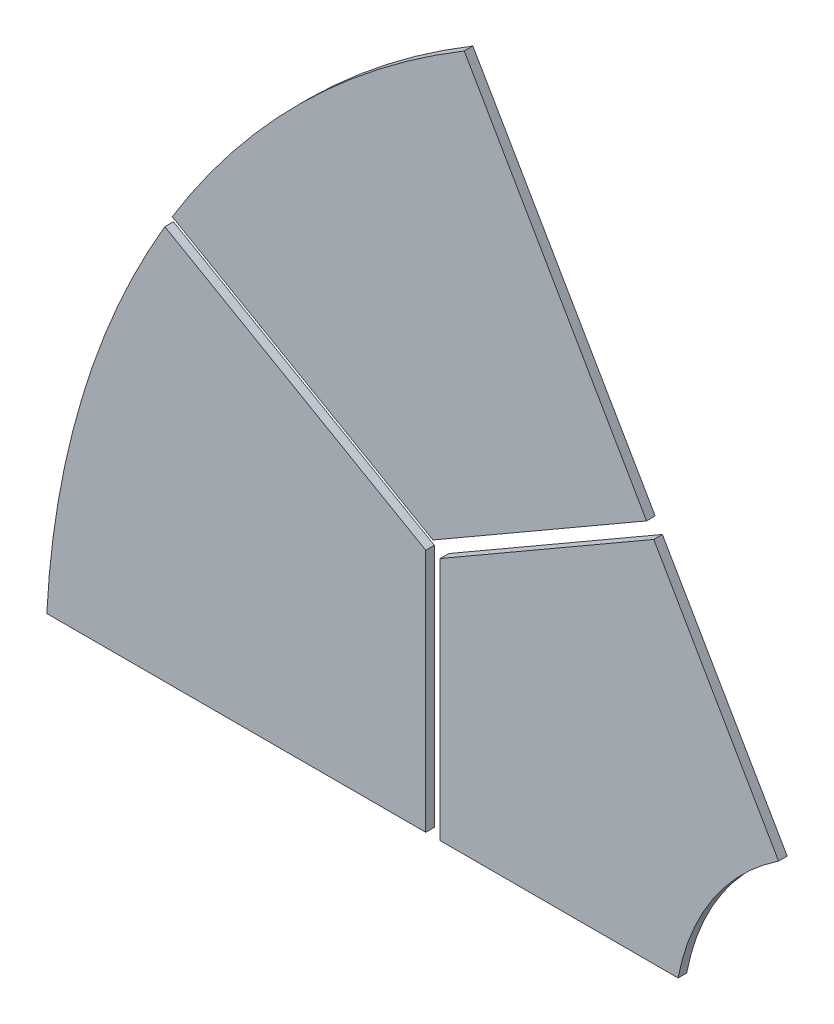
from build123d import *

# Parameters (mm, degrees)
BOSS_EXTRUDE2_DEPTH   = 6
BOSS_EXTRUDE2_2_DEPTH = 6
BOSS_EXTRUDE2_3_DEPTH = 6


with BuildPart() as part:
    # Sketch1 → Boss-Extrude2 (new body)
    with BuildSketch(Plane.XY):
        with BuildLine():
            Line((-335.2, 199.966608393), (-516.736885171, 304.143307511))
            ThreePointArc((-516.736885171, 304.143307511), (-574.388040835, 172.042258023), (-598.849029389, 30))
            Line((-598.849029389, 30), (-335.2, 30))
            Line((-335.2, 30), (-335.2, 199.966608393))
        make_face()
    extrude(amount=BOSS_EXTRUDE2_DEPTH)


with BuildPart() as body_2:
    # Sketch1 → Boss-Extrude2 2 (new body)
    with BuildSketch(Plane.XY):
        with BuildLine():
            Line((-181.552122678, 294.457500701), (-308.418556675, 514.196610158))
            ThreePointArc((-308.418556675, 514.196610158), (-422.199493266, 425.755502473), (-511.591783696, 312.720333293))
            Line((-511.591783696, 312.720333293), (-330.207563047, 208.631242188))
            Line((-330.207563047, 208.631242188), (-181.552122678, 294.457500701))
        make_face()
    extrude(amount=BOSS_EXTRUDE2_2_DEPTH)


with BuildPart() as body_3:
    # Sketch1 → Boss-Extrude2 3 (new body)
    with BuildSketch(Plane.XY):
        with BuildLine():
            ThreePointArc((-89.706166951, 135.375638912), (-135.333005446, 89.770471966), (-159.605012453, 30))
            Line((-159.605012453, 30), (-325.2, 30))
            Line((-325.2, 30), (-325.2, 199.975354677))
            Line((-325.2, 199.975354677), (-176.552122678, 285.797246663))
            Line((-176.552122678, 285.797246663), (-89.706166951, 135.375638912))
        make_face()
    extrude(amount=BOSS_EXTRUDE2_3_DEPTH)


solid = Compound([part.part, body_2.part, body_3.part])
